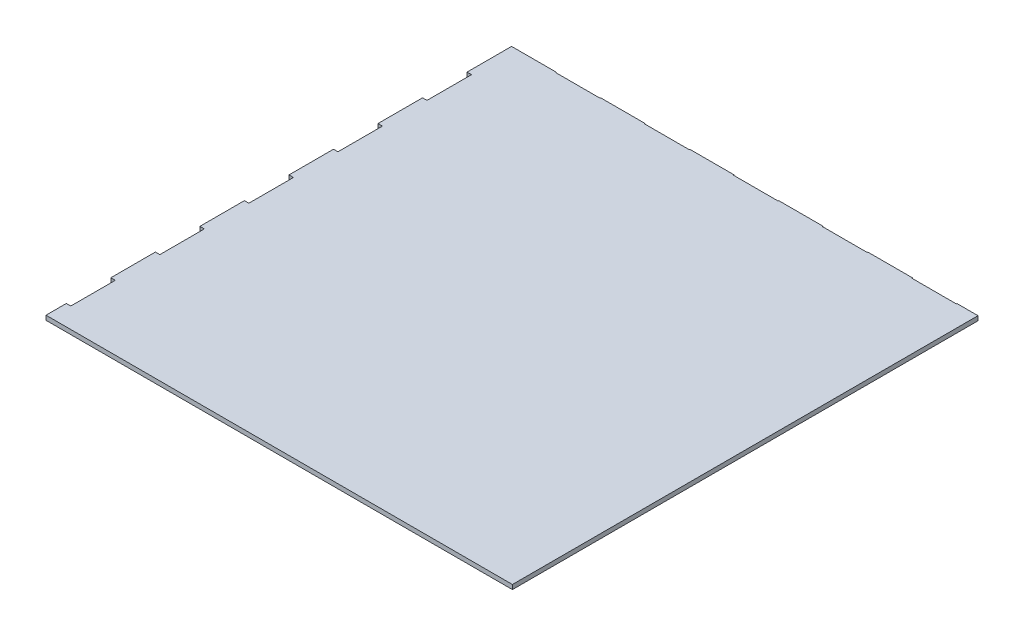
from build123d import *

# Parameters (mm, degrees)
SKETCH1_W               = 630
SKETCH1_H               = 630
BOSS_EXTRUDE1_DEPTH     = 3
SKETCH3_W               = 3
SKETCH3_H               = 30
CUT_EXTRUDE2_DEPTH      = 3
LPATTERN2_COUNT         = 10
LPATTERN2_PITCH         = 60
MIRROR1_COPY_1_SKETCH_W = 3
MIRROR1_COPY_1_SKETCH_H = 30
MIRROR1_COPY_1_DEPTH    = 3
MIRROR1_COPY_2_SKETCH_W = 3
MIRROR1_COPY_2_SKETCH_H = 30
MIRROR1_COPY_2_DEPTH    = 3
MIRROR1_COPY_3_SKETCH_W = 3
MIRROR1_COPY_3_SKETCH_H = 30
MIRROR1_COPY_3_DEPTH    = 3
MIRROR1_COPY_4_SKETCH_W = 3
MIRROR1_COPY_4_SKETCH_H = 30
MIRROR1_COPY_4_DEPTH    = 3
MIRROR1_COPY_5_SKETCH_W = 3
MIRROR1_COPY_5_SKETCH_H = 30
MIRROR1_COPY_5_DEPTH    = 3
MIRROR1_COPY_6_SKETCH_W = 3
MIRROR1_COPY_6_SKETCH_H = 30
MIRROR1_COPY_6_DEPTH    = 3
MIRROR1_COPY_7_SKETCH_W = 3
MIRROR1_COPY_7_SKETCH_H = 30
MIRROR1_COPY_7_DEPTH    = 3
MIRROR1_COPY_8_SKETCH_W = 3
MIRROR1_COPY_8_SKETCH_H = 30
MIRROR1_COPY_8_DEPTH    = 3
MIRROR1_COPY_9_SKETCH_W = 3
MIRROR1_COPY_9_SKETCH_H = 30
MIRROR1_COPY_9_DEPTH    = 3
SKETCH5_W               = 30
SKETCH5_H               = 3
CUT_EXTRUDE3_DEPTH      = 3
LPATTERN3_COUNT         = 10
LPATTERN3_PITCH         = 60
MIRROR2_COPY_1_SKETCH_W = 30
MIRROR2_COPY_1_SKETCH_H = 3
MIRROR2_COPY_1_DEPTH    = 3
MIRROR2_COPY_2_SKETCH_W = 30
MIRROR2_COPY_2_SKETCH_H = 3
MIRROR2_COPY_2_DEPTH    = 3
MIRROR2_COPY_3_SKETCH_W = 30
MIRROR2_COPY_3_SKETCH_H = 3
MIRROR2_COPY_3_DEPTH    = 3
MIRROR2_COPY_4_SKETCH_W = 30
MIRROR2_COPY_4_SKETCH_H = 3
MIRROR2_COPY_4_DEPTH    = 3
MIRROR2_COPY_5_SKETCH_W = 30
MIRROR2_COPY_5_SKETCH_H = 3
MIRROR2_COPY_5_DEPTH    = 3
MIRROR2_COPY_6_SKETCH_W = 30
MIRROR2_COPY_6_SKETCH_H = 3
MIRROR2_COPY_6_DEPTH    = 3
MIRROR2_COPY_7_SKETCH_W = 30
MIRROR2_COPY_7_SKETCH_H = 3
MIRROR2_COPY_7_DEPTH    = 3
MIRROR2_COPY_8_SKETCH_W = 30
MIRROR2_COPY_8_SKETCH_H = 3
MIRROR2_COPY_8_DEPTH    = 3
MIRROR2_COPY_9_SKETCH_W = 30
MIRROR2_COPY_9_SKETCH_H = 3
MIRROR2_COPY_9_DEPTH    = 3


with BuildPart() as part:
    # Sketch1 → Boss-Extrude1 (new body)
    with BuildSketch(Plane(origin=(0, 0, 0), x_dir=(1, 0, 0), z_dir=(0, 1, 0))):
        Rectangle(SKETCH1_W, SKETCH1_H)
    extrude(amount=BOSS_EXTRUDE1_DEPTH)

    # Sketch3 → Cut-Extrude2 (cut)
    with BuildSketch(Plane(origin=(0, 3, 0), x_dir=(1, 0, 0), z_dir=(0, 1, 0))):
        with Locations((-313.5, -270.006843512)):
            Rectangle(SKETCH3_W, SKETCH3_H)
    cut_extrude2 = extrude(amount=-CUT_EXTRUDE2_DEPTH, mode=Mode.SUBTRACT)

    # LPattern2: Cut-Extrude2 ×10
    with Locations(*[(0, 0, -i * LPATTERN2_PITCH) for i in range(1, LPATTERN2_COUNT)]):
        add(cut_extrude2, mode=Mode.SUBTRACT)

    # Mirror1: Cut-Extrude2 across plane
    add(cut_extrude2.mirror(Plane(origin=(-0.72, 0, 0), x_dir=(0, 0, 1), z_dir=(1, 0, 0))), mode=Mode.SUBTRACT)

    # Mirror1 copy 1 sketch → Mirror1 copy 1 (cut)
    with BuildSketch(Plane(origin=(-1.44, 3, -60), x_dir=(-1, 0, 0), z_dir=(0, 1, 0))):
        with Locations((-313.5, 270.006843512)):
            Rectangle(MIRROR1_COPY_1_SKETCH_W, MIRROR1_COPY_1_SKETCH_H)
    extrude(amount=-MIRROR1_COPY_1_DEPTH, mode=Mode.SUBTRACT)

    # Mirror1 copy 2 sketch → Mirror1 copy 2 (cut)
    with BuildSketch(Plane(origin=(-1.44, 3, -120), x_dir=(-1, 0, 0), z_dir=(0, 1, 0))):
        with Locations((-313.5, 270.006843512)):
            Rectangle(MIRROR1_COPY_2_SKETCH_W, MIRROR1_COPY_2_SKETCH_H)
    extrude(amount=-MIRROR1_COPY_2_DEPTH, mode=Mode.SUBTRACT)

    # Mirror1 copy 3 sketch → Mirror1 copy 3 (cut)
    with BuildSketch(Plane(origin=(-1.44, 3, -180), x_dir=(-1, 0, 0), z_dir=(0, 1, 0))):
        with Locations((-313.5, 270.006843512)):
            Rectangle(MIRROR1_COPY_3_SKETCH_W, MIRROR1_COPY_3_SKETCH_H)
    extrude(amount=-MIRROR1_COPY_3_DEPTH, mode=Mode.SUBTRACT)

    # Mirror1 copy 4 sketch → Mirror1 copy 4 (cut)
    with BuildSketch(Plane(origin=(-1.44, 3, -240), x_dir=(-1, 0, 0), z_dir=(0, 1, 0))):
        with Locations((-313.5, 270.006843512)):
            Rectangle(MIRROR1_COPY_4_SKETCH_W, MIRROR1_COPY_4_SKETCH_H)
    extrude(amount=-MIRROR1_COPY_4_DEPTH, mode=Mode.SUBTRACT)

    # Mirror1 copy 5 sketch → Mirror1 copy 5 (cut)
    with BuildSketch(Plane(origin=(-1.44, 3, -300), x_dir=(-1, 0, 0), z_dir=(0, 1, 0))):
        with Locations((-313.5, 270.006843512)):
            Rectangle(MIRROR1_COPY_5_SKETCH_W, MIRROR1_COPY_5_SKETCH_H)
    extrude(amount=-MIRROR1_COPY_5_DEPTH, mode=Mode.SUBTRACT)

    # Mirror1 copy 6 sketch → Mirror1 copy 6 (cut)
    with BuildSketch(Plane(origin=(-1.44, 3, -360), x_dir=(-1, 0, 0), z_dir=(0, 1, 0))):
        with Locations((-313.5, 270.006843512)):
            Rectangle(MIRROR1_COPY_6_SKETCH_W, MIRROR1_COPY_6_SKETCH_H)
    extrude(amount=-MIRROR1_COPY_6_DEPTH, mode=Mode.SUBTRACT)

    # Mirror1 copy 7 sketch → Mirror1 copy 7 (cut)
    with BuildSketch(Plane(origin=(-1.44, 3, -420), x_dir=(-1, 0, 0), z_dir=(0, 1, 0))):
        with Locations((-313.5, 270.006843512)):
            Rectangle(MIRROR1_COPY_7_SKETCH_W, MIRROR1_COPY_7_SKETCH_H)
    extrude(amount=-MIRROR1_COPY_7_DEPTH, mode=Mode.SUBTRACT)

    # Mirror1 copy 8 sketch → Mirror1 copy 8 (cut)
    with BuildSketch(Plane(origin=(-1.44, 3, -480), x_dir=(-1, 0, 0), z_dir=(0, 1, 0))):
        with Locations((-313.5, 270.006843512)):
            Rectangle(MIRROR1_COPY_8_SKETCH_W, MIRROR1_COPY_8_SKETCH_H)
    extrude(amount=-MIRROR1_COPY_8_DEPTH, mode=Mode.SUBTRACT)

    # Mirror1 copy 9 sketch → Mirror1 copy 9 (cut)
    with BuildSketch(Plane(origin=(-1.44, 3, -540), x_dir=(-1, 0, 0), z_dir=(0, 1, 0))):
        with Locations((-313.5, 270.006843512)):
            Rectangle(MIRROR1_COPY_9_SKETCH_W, MIRROR1_COPY_9_SKETCH_H)
    extrude(amount=-MIRROR1_COPY_9_DEPTH, mode=Mode.SUBTRACT)

    # Sketch5 → Cut-Extrude3 (cut)
    with BuildSketch(Plane(origin=(0, 3, 0), x_dir=(1, 0, 0), z_dir=(0, 1, 0))):
        with Locations((-270.000314512, -313.5)):
            Rectangle(SKETCH5_W, SKETCH5_H)
    cut_extrude3 = extrude(amount=-CUT_EXTRUDE3_DEPTH, mode=Mode.SUBTRACT)

    # LPattern3: Cut-Extrude3 ×10
    with Locations(*[(i * LPATTERN3_PITCH, 0, 0) for i in range(1, LPATTERN3_COUNT)]):
        add(cut_extrude3, mode=Mode.SUBTRACT)

    # Mirror2: Cut-Extrude3 across plane
    add(cut_extrude3.mirror(Plane.XY.offset(-1.29)), mode=Mode.SUBTRACT)

    # Mirror2 copy 1 sketch → Mirror2 copy 1 (cut)
    with BuildSketch(Plane(origin=(60, 3, -2.58), x_dir=(1, 0, 0), z_dir=(0, 1, 0))):
        with Locations((-270.000314512, 313.5)):
            Rectangle(MIRROR2_COPY_1_SKETCH_W, MIRROR2_COPY_1_SKETCH_H)
    extrude(amount=-MIRROR2_COPY_1_DEPTH, mode=Mode.SUBTRACT)

    # Mirror2 copy 2 sketch → Mirror2 copy 2 (cut)
    with BuildSketch(Plane(origin=(120, 3, -2.58), x_dir=(1, 0, 0), z_dir=(0, 1, 0))):
        with Locations((-270.000314512, 313.5)):
            Rectangle(MIRROR2_COPY_2_SKETCH_W, MIRROR2_COPY_2_SKETCH_H)
    extrude(amount=-MIRROR2_COPY_2_DEPTH, mode=Mode.SUBTRACT)

    # Mirror2 copy 3 sketch → Mirror2 copy 3 (cut)
    with BuildSketch(Plane(origin=(180, 3, -2.58), x_dir=(1, 0, 0), z_dir=(0, 1, 0))):
        with Locations((-270.000314512, 313.5)):
            Rectangle(MIRROR2_COPY_3_SKETCH_W, MIRROR2_COPY_3_SKETCH_H)
    extrude(amount=-MIRROR2_COPY_3_DEPTH, mode=Mode.SUBTRACT)

    # Mirror2 copy 4 sketch → Mirror2 copy 4 (cut)
    with BuildSketch(Plane(origin=(240, 3, -2.58), x_dir=(1, 0, 0), z_dir=(0, 1, 0))):
        with Locations((-270.000314512, 313.5)):
            Rectangle(MIRROR2_COPY_4_SKETCH_W, MIRROR2_COPY_4_SKETCH_H)
    extrude(amount=-MIRROR2_COPY_4_DEPTH, mode=Mode.SUBTRACT)

    # Mirror2 copy 5 sketch → Mirror2 copy 5 (cut)
    with BuildSketch(Plane(origin=(300, 3, -2.58), x_dir=(1, 0, 0), z_dir=(0, 1, 0))):
        with Locations((-270.000314512, 313.5)):
            Rectangle(MIRROR2_COPY_5_SKETCH_W, MIRROR2_COPY_5_SKETCH_H)
    extrude(amount=-MIRROR2_COPY_5_DEPTH, mode=Mode.SUBTRACT)

    # Mirror2 copy 6 sketch → Mirror2 copy 6 (cut)
    with BuildSketch(Plane(origin=(360, 3, -2.58), x_dir=(1, 0, 0), z_dir=(0, 1, 0))):
        with Locations((-270.000314512, 313.5)):
            Rectangle(MIRROR2_COPY_6_SKETCH_W, MIRROR2_COPY_6_SKETCH_H)
    extrude(amount=-MIRROR2_COPY_6_DEPTH, mode=Mode.SUBTRACT)

    # Mirror2 copy 7 sketch → Mirror2 copy 7 (cut)
    with BuildSketch(Plane(origin=(420, 3, -2.58), x_dir=(1, 0, 0), z_dir=(0, 1, 0))):
        with Locations((-270.000314512, 313.5)):
            Rectangle(MIRROR2_COPY_7_SKETCH_W, MIRROR2_COPY_7_SKETCH_H)
    extrude(amount=-MIRROR2_COPY_7_DEPTH, mode=Mode.SUBTRACT)

    # Mirror2 copy 8 sketch → Mirror2 copy 8 (cut)
    with BuildSketch(Plane(origin=(480, 3, -2.58), x_dir=(1, 0, 0), z_dir=(0, 1, 0))):
        with Locations((-270.000314512, 313.5)):
            Rectangle(MIRROR2_COPY_8_SKETCH_W, MIRROR2_COPY_8_SKETCH_H)
    extrude(amount=-MIRROR2_COPY_8_DEPTH, mode=Mode.SUBTRACT)

    # Mirror2 copy 9 sketch → Mirror2 copy 9 (cut)
    with BuildSketch(Plane(origin=(540, 3, -2.58), x_dir=(1, 0, 0), z_dir=(0, 1, 0))):
        with Locations((-270.000314512, 313.5)):
            Rectangle(MIRROR2_COPY_9_SKETCH_W, MIRROR2_COPY_9_SKETCH_H)
    extrude(amount=-MIRROR2_COPY_9_DEPTH, mode=Mode.SUBTRACT)

    # SurfaceCut1
    split(bisect_by=Plane.XY.offset(-1.29), keep=Keep.BOTTOM)

    # SurfaceCut2
    split(bisect_by=Plane(origin=(-0.72, 0, 0), x_dir=(0, 0, -1), z_dir=(1, 0, 0)), keep=Keep.BOTTOM)


solid = part.part
